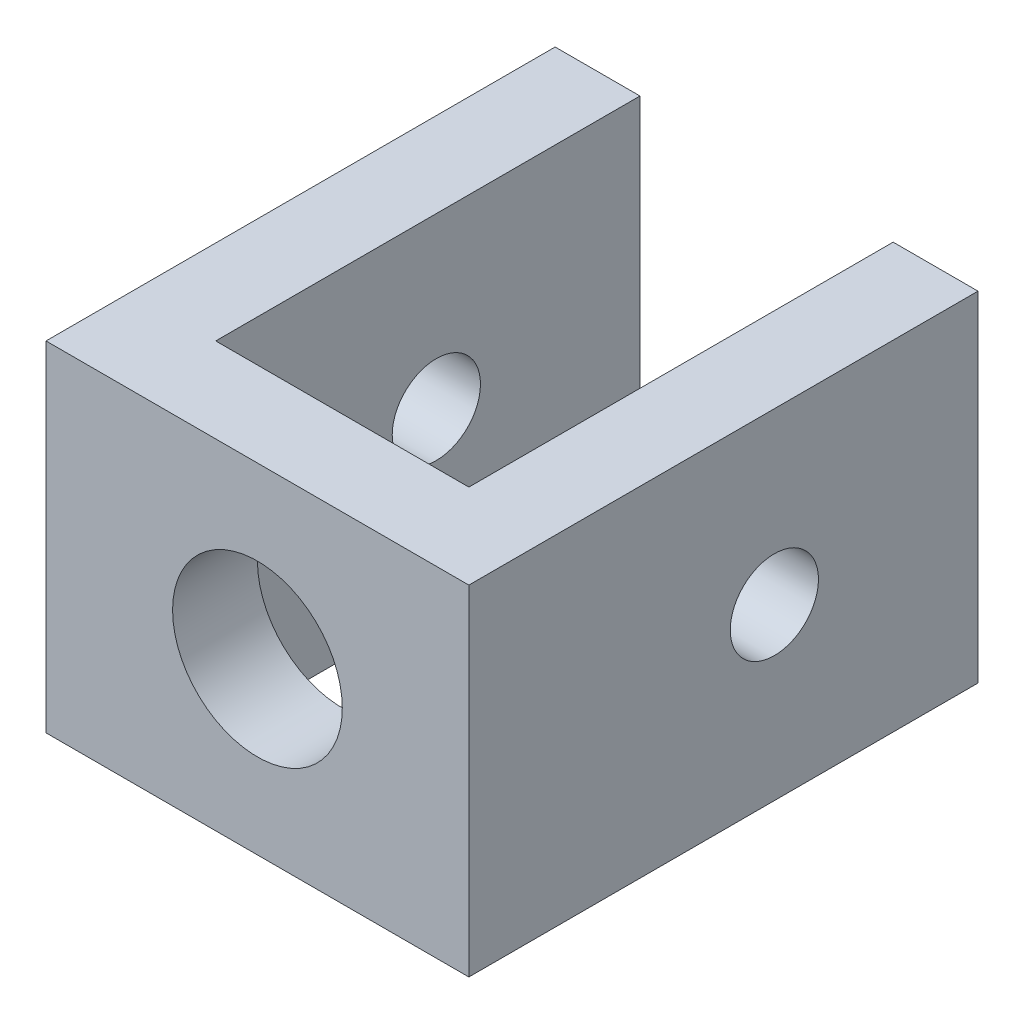
from build123d import *

# Parameters (mm, degrees)
BOSS_EXTRUDE1_DEPTH     = 25.4
SKETCH2_R               = 6.35
CUT_EXTRUDE1_DEPTH      = 56.660932074
CUT_EXTRUDE2_DEPTH      = 53.31230942
CUT_EXTRUDE2_DEPTH_BACK = 53.31230942
SKETCH5_R               = 3.302


with BuildPart() as part:
    # Sketch1 → Boss-Extrude1 (new body)
    with BuildSketch(Plane(origin=(0, 0, 0), x_dir=(1, 0, 0), z_dir=(0, 1, 0))):
        Polygon((0, 0), (0, 38.1), (6.35, 38.1), (6.35, 6.35), (25.294420667, 6.35), (25.294420667, 38.1), (31.644420667, 38.1), (31.644420667, 0), align=None)
    extrude(amount=BOSS_EXTRUDE1_DEPTH)

    # Sketch2 → Cut-Extrude1 (cut, through all)
    with BuildSketch(Plane.XY):
        with Locations((15.822210333, 12.7)):
            Circle(SKETCH2_R)
    extrude(amount=-CUT_EXTRUDE1_DEPTH, mode=Mode.SUBTRACT)

    # Sketch5 → Cut-Extrude2 (cut, two sides: drawn at the far end of the back side and taken through both)
    with BuildSketch(Plane(origin=(6.35, 0, 0), x_dir=(0, 0, -1), z_dir=(1, 0, 0)).offset(-CUT_EXTRUDE2_DEPTH_BACK)):
        with Locations((22.86, 12.7)):
            Circle(SKETCH5_R)
    extrude(amount=CUT_EXTRUDE2_DEPTH + CUT_EXTRUDE2_DEPTH_BACK, mode=Mode.SUBTRACT)


solid = part.part
